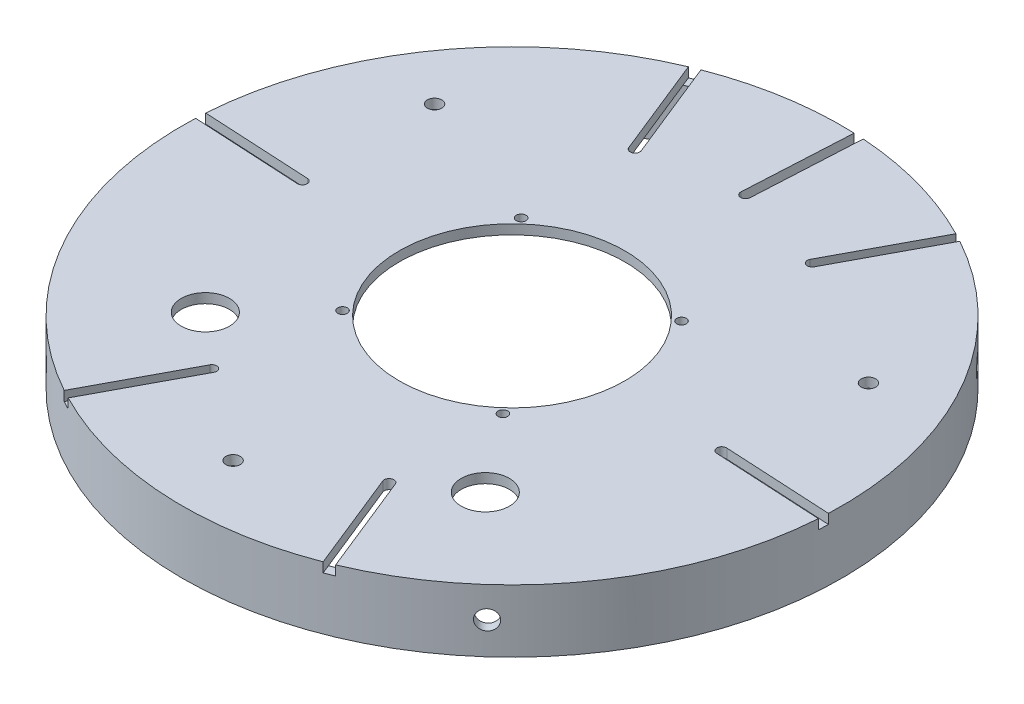
from build123d import *

# Parameters (mm, degrees)
SKETCH1_R                = 68.369999998
SKETCH1_R_2              = 23.401
BOSS_EXTRUDE1_DEPTH      = 2
BOSS_EXTRUDE2_START      = -13
SKETCH3_R                = 68.369999998
SKETCH3_R_2              = 66.37
BOSS_EXTRUDE2_DEPTH      = 13
CUT_EXTRUDE40_DEPTH      = 114.575806629
CUT_EXTRUDE40_DEPTH_BACK = 114.575806629
SKETCH63_R               = 2
CUT_EXTRUDE41_DEPTH      = 160.130961581
CUT_EXTRUDE41_DEPTH_BACK = 160.130961581
SKETCH64_R               = 2
CUT_EXTRUDE45_DEPTH      = 2
SKETCH73_R               = 1
CUT_EXTRUDE47_DEPTH      = 10
SKETCH70_R               = 1.5
CUT_EXTRUDE48_DEPTH      = 10
SKETCH74_R               = 5
CUT_EXTRUDE49_DEPTH      = 10
CUT_EXTRUDE51_START      = -2
CUT_EXTRUDE51_DEPTH      = 2


with BuildPart() as part:
    # Sketch1 → Boss-Extrude1 (new body)
    with BuildSketch(Plane(origin=(0, 0, 0), x_dir=(-0.9985653746512714, 0, -0.053546172109368295), z_dir=(0, 1, 0))):
        with Locations(Location((55.498672647, -32.344920806, 0), (0, 0, 93.069437642))):
            Circle(SKETCH1_R)
        with Locations(Location((55.498672647, -32.344920806, 0), (0, 0, 93.069437642))):
            Circle(SKETCH1_R_2, mode=Mode.SUBTRACT)
    extrude(amount=BOSS_EXTRUDE1_DEPTH)

    # Sketch3 → Boss-Extrude2 (add)
    with BuildSketch(Plane(origin=(0, 2, 0), x_dir=(1, 0, 0), z_dir=(0, 1, 0)).offset(BOSS_EXTRUDE2_START)):
        with Locations(Location((-53.687106148, 35.27025944, 0), (0, 0, 270))):
            Circle(SKETCH3_R)
        with Locations(Location((-53.687106148, 35.27025944, 0), (0, 0, 270))):
            Circle(SKETCH3_R_2, mode=Mode.SUBTRACT)
    extrude(amount=BOSS_EXTRUDE2_DEPTH)

    # Sketch63 → Cut-Extrude40 (cut, two sides: drawn at the far end of the back side and taken through both)
    with BuildSketch(Plane(origin=(-41.506941316, 0, -46.21062949), x_dir=(0.7439552092791144, 2.284460434874975e-13, -0.6682294864688846), z_dir=(0.6682294864688846, -2.5433421830845933e-13, 0.7439552092791144)).offset(-CUT_EXTRUDE40_DEPTH_BACK)):
        with Locations((-16.372174937, -4.35)):
            Circle(SKETCH63_R)
    extrude(amount=CUT_EXTRUDE40_DEPTH + CUT_EXTRUDE40_DEPTH_BACK, mode=Mode.SUBTRACT)

    # Sketch64 → Cut-Extrude41 (cut, two sides: drawn at the far end of the back side and taken through both)
    with BuildSketch(Plane(origin=(-12.180164832, 0, 10.94037005), x_dir=(-0.668229486468876, 1.5883353274739987e-15, -0.743955209279122), z_dir=(0.743955209279122, -1.7683301393964735e-15, -0.668229486468876)).offset(-CUT_EXTRUDE41_DEPTH_BACK)):
        with Locations((62.114800614, -4.35)):
            Circle(SKETCH64_R)
    extrude(amount=CUT_EXTRUDE41_DEPTH + CUT_EXTRUDE41_DEPTH_BACK, mode=Mode.SUBTRACT)

    # Sketch67 → Cut-Extrude45 (cut)
    with BuildSketch(Plane(origin=(0, 2, 0), x_dir=(1, 0, 0), z_dir=(0, 1, 0))):
        with BuildLine():
            Line((-47.831144931, 125.709400378), (-49.82827568, 125.816492726))
            Line((-49.82827568, 125.816492726), (-52.215508738, 81.297751413))
            ThreePointArc((-52.215508738, 81.297751413), (-51.270489538, 80.245639864), (-50.218377989, 81.190659065))
            Line((-50.218377989, 81.190659065), (-47.831144931, 125.709400378))
        make_face()
        with BuildLine():
            Line((-144.126247086, 41.126220657), (-144.233339434, 39.129089908))
            Line((-144.233339434, 39.129089908), (-99.714598121, 36.741856849))
            ThreePointArc((-99.714598121, 36.741856849), (-98.662486572, 37.68687605), (-99.607505773, 38.738987598))
            Line((-99.607505773, 38.738987598), (-144.126247086, 41.126220657))
        make_face()
        with BuildLine():
            Line((36.75203479, 29.414298222), (36.859127139, 31.411428971))
            Line((36.859127139, 31.411428971), (-7.659614175, 33.79866203))
            ThreePointArc((-7.659614175, 33.79866203), (-8.711725723, 32.853642829), (-7.766706523, 31.801531281))
            Line((-7.766706523, 31.801531281), (36.75203479, 29.414298222))
        make_face()
    extrude(amount=-CUT_EXTRUDE45_DEPTH, mode=Mode.SUBTRACT)

    # Sketch73 → Cut-Extrude47 (cut)
    with BuildSketch(Plane.XZ.offset(-2)):
        with Locations(Location((-72.2141021, -18.632644766, 0), (0, 0, 90))):
            Circle(SKETCH73_R)
        with Locations(Location((-37.049491474, -16.743263487, 0), (0, 0, 90))):
            Circle(SKETCH73_R)
        with Locations(Location((-35.160110195, -51.907874114, 0), (0, 0, 90))):
            Circle(SKETCH73_R)
        with Locations(Location((-70.324720822, -53.797255392, 0), (0, 0, 90))):
            Circle(SKETCH73_R)
    extrude(amount=CUT_EXTRUDE47_DEPTH, mode=Mode.SUBTRACT)

    # Sketch70 → Cut-Extrude48 (cut)
    with BuildSketch(Plane(origin=(0, 2, 0), x_dir=(1, 0, 0), z_dir=(0, 1, 0))):
        with Locations(Location((-99.774462502, 65.286181619, 0), (0, 0, 270))):
            Circle(SKETCH70_R)
        with Locations(Location((-56.637979096, -19.650523046, 0), (0, 0, 270))):
            Circle(SKETCH70_R)
        with Locations(Location((-4.648876845, 60.175119746, 0), (0, 0, 270))):
            Circle(SKETCH70_R)
    extrude(amount=-CUT_EXTRUDE48_DEPTH, mode=Mode.SUBTRACT)

    # Sketch74 → Cut-Extrude49 (cut)
    with BuildSketch(Plane(origin=(19.562495047, 3, -2.053609117), x_dir=(1, 0, 0), z_dir=(0, 1, 0))):
        with Locations(Location((-105.702188225, 2.042468777, 0), (0, 0, 270))):
            Circle(SKETCH74_R)
        with Locations(Location((-44.324158759, -1.255349618, 0), (0, 0, 270))):
            Circle(SKETCH74_R)
    extrude(amount=-CUT_EXTRUDE49_DEPTH, mode=Mode.SUBTRACT)

    # Sketch75 → Cut-Extrude51 (cut)
    with BuildSketch(Plane(origin=(0, 2, 0), x_dir=(1, 0, 0), z_dir=(0, 1, 0)).offset(CUT_EXTRUDE51_START)):
        with BuildLine():
            ThreePointArc((-78.28711428, 99.061297209), (-79.21750955, 98.694666428), (-80.142442845, 98.314466628))
            Line((-80.142442845, 98.314466628), (-79.765783898, 97.378744227))
            Line((-79.765783898, 97.378744227), (-71.802851111, 77.596671772))
            ThreePointArc((-71.802851111, 77.596671772), (-70.501771538, 77.04242278), (-69.947522546, 78.343502353))
            Line((-69.947522546, 78.343502353), (-77.910455333, 98.125574808))
            Line((-77.910455333, 98.125574808), (-78.28711428, 99.061297209))
        make_face()
        with BuildLine():
            Line((-21.107609811, 94.229039398), (-20.63291657, 95.119047657))
            ThreePointArc((-20.63291657, 95.119047657), (-21.511818593, 95.596106061), (-22.397604199, 96.060258351))
            Line((-22.397604199, 96.060258351), (-22.872297441, 95.170250092))
            Line((-22.872297441, 95.170250092), (-32.907769586, 76.354618611))
            ThreePointArc((-32.907769586, 76.354618611), (-32.496031118, 75.00166945), (-31.143081956, 75.413407918))
            Line((-31.143081956, 75.413407918), (-21.107609811, 94.229039398))
        make_face()
        with BuildLine():
            Line((-76.23113034, -4.872889039), (-86.266602485, -23.688520519))
            Line((-86.266602485, -23.688520519), (-86.741295726, -24.578528778))
            ThreePointArc((-86.741295726, -24.578528778), (-85.862393702, -25.055587182), (-84.976608096, -25.519739471))
            Line((-84.976608096, -25.519739471), (-84.501914855, -24.629731212))
            Line((-84.501914855, -24.629731212), (-74.46644271, -5.814099732))
            ThreePointArc((-74.46644271, -5.814099732), (-74.878181178, -4.461150571), (-76.23113034, -4.872889039))
        make_face()
        with BuildLine():
            Line((-29.463756963, -27.585055929), (-29.087098016, -28.52077833))
            ThreePointArc((-29.087098016, -28.52077833), (-28.156702745, -28.154147549), (-27.231769451, -27.773947749))
            Line((-27.231769451, -27.773947749), (-27.608428398, -26.838225348))
            Line((-27.608428398, -26.838225348), (-35.571361185, -7.056152893))
            ThreePointArc((-35.571361185, -7.056152893), (-36.872440758, -6.501903901), (-37.42668975, -7.802983474))
            Line((-37.42668975, -7.802983474), (-29.463756963, -27.585055929))
        make_face()
    extrude(amount=CUT_EXTRUDE51_DEPTH, mode=Mode.SUBTRACT)


solid = part.part
